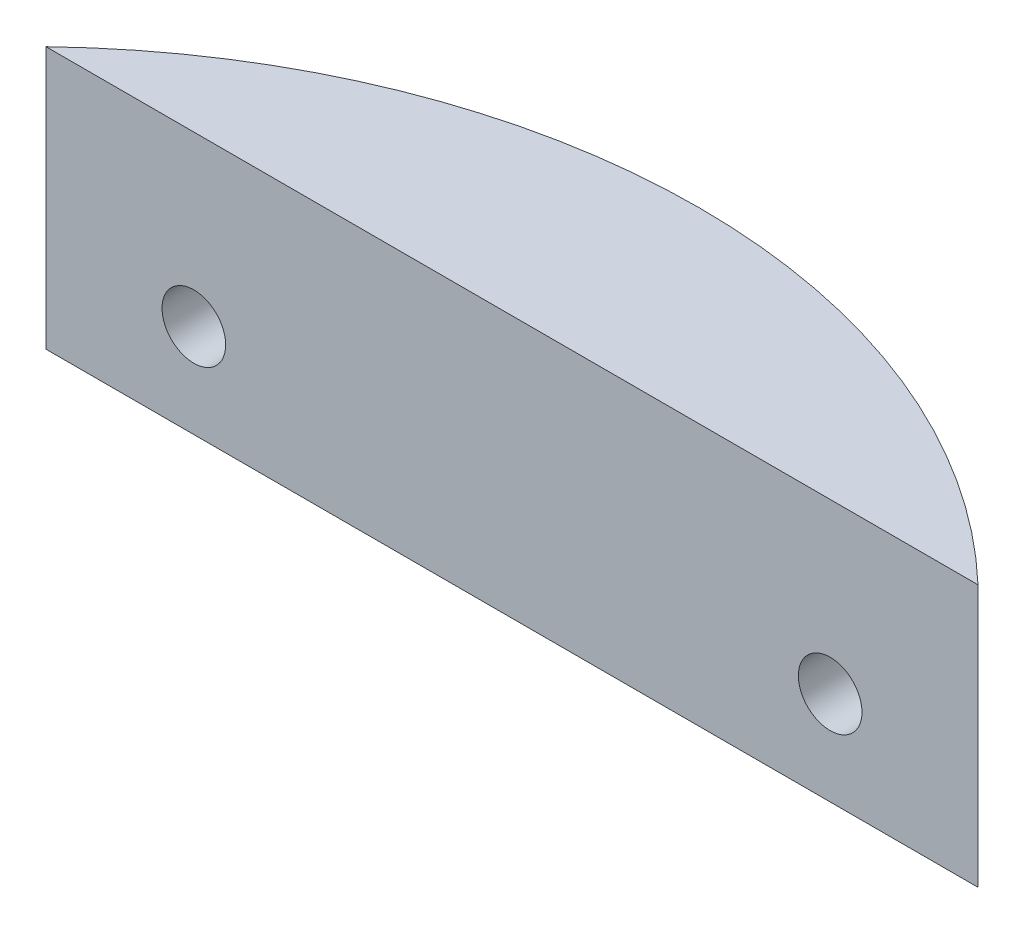
from build123d import *

# Parameters (mm, degrees)
BOSS_EXTRUDE1_DEPTH = 35
SKETCH2_R           = 4.25
CUT_EXTRUDE1_DEPTH  = 10


with BuildPart() as part:
    # Sketch1 → Boss-Extrude1 (new body)
    with BuildSketch(Plane(origin=(0, 0, 0), x_dir=(1, 0, 0), z_dir=(0, 1, 0))):
        with BuildLine():
            Line((-62.24949799, 65), (62.24949799, 65))
            ThreePointArc((62.24949799, 65), (0, 90), (-62.24949799, 65))
        make_face()
    extrude(amount=BOSS_EXTRUDE1_DEPTH)

    # Sketch2 → Cut-Extrude1 (cut)
    with BuildSketch(Plane.XY.offset(-65)):
        with Locations((-42.5, 12.5)):
            Circle(SKETCH2_R)
        with Locations((42.5, 12.5)):
            Circle(SKETCH2_R)
    extrude(amount=-CUT_EXTRUDE1_DEPTH, mode=Mode.SUBTRACT)


solid = part.part
